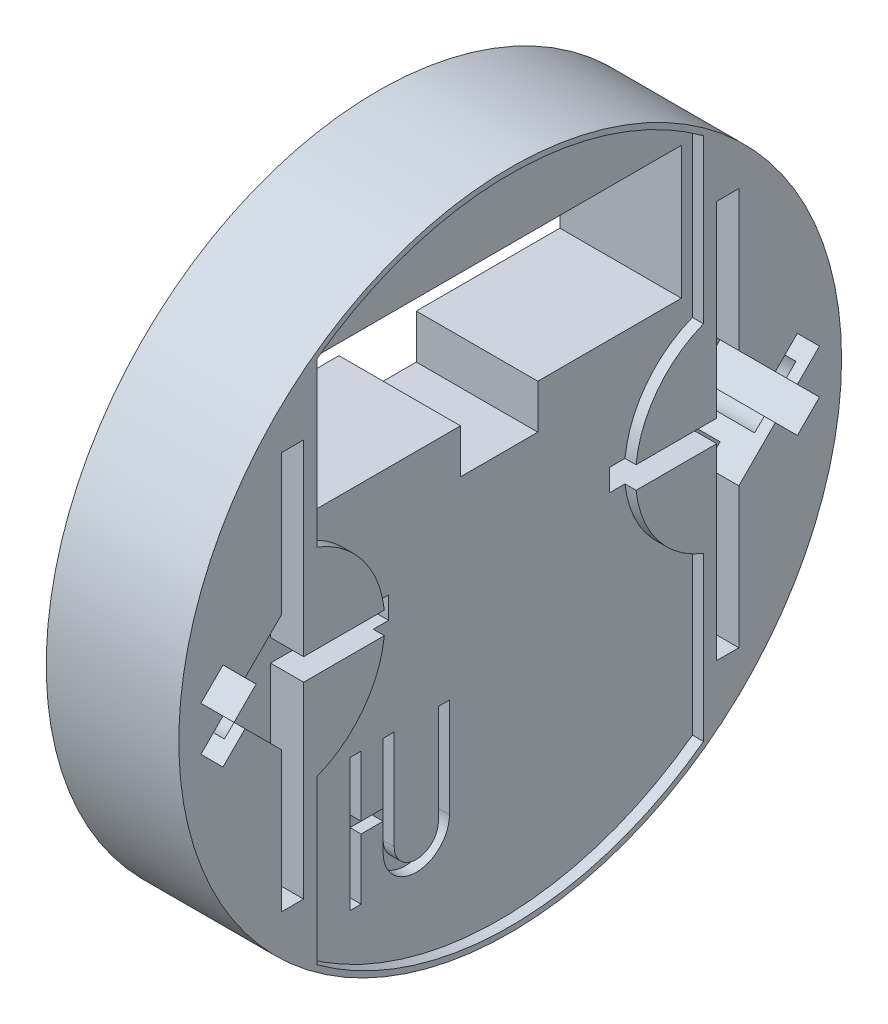
from build123d import *

# Parameters (mm, degrees)
SKETCH1_R           = 15
BOSS_EXTRUDE1_DEPTH = 6
CUT_EXTRUDE1_DEPTH  = 0.5
CUT_EXTRUDE2_DEPTH  = 22.914607001
CUT_EXTRUDE4_DEPTH  = 1.5
CUT_EXTRUDE5_DEPTH  = 22.685248442
CUT_EXTRUDE7_DEPTH  = 0.5
SKETCH7_R           = 1.5
CUT_EXTRUDE6_DEPTH  = 10


with BuildPart() as part:
    # Sketch1 → Boss-Extrude1 (new body)
    with BuildSketch(Plane(origin=(0, 0, 0), x_dir=(0, 0, -1), z_dir=(1, 0, 0))):
        Circle(SKETCH1_R)
    extrude(amount=BOSS_EXTRUDE1_DEPTH)

    # Sketch2 → Cut-Extrude1 (cut)
    with BuildSketch(Plane(origin=(6, 0, 0), x_dir=(0, 0, -1), z_dir=(1, 0, 0))):
        with BuildLine():
            Line((-8.75, 11.874342087), (-8.75, 4.5))
            ThreePointArc((-8.75, 4.5), (-5.671698021, 0), (-8.75, -4.5))
            Line((-8.75, -4.5), (-8.75, -11.874342087))
            ThreePointArc((-8.75, -11.874342087), (0, -14.75), (8.75, -11.874342087))
            Line((8.75, -11.874342087), (8.75, -4.5))
            ThreePointArc((8.75, -4.5), (5.671698021, 0), (8.75, 4.5))
            Line((8.75, 4.5), (8.75, 11.874342087))
            ThreePointArc((8.75, 11.874342087), (0, 14.75), (-8.75, 11.874342087))
        make_face()
    extrude(amount=-CUT_EXTRUDE1_DEPTH, mode=Mode.SUBTRACT)

    # Sketch3 → Cut-Extrude2 (cut, through all)
    with BuildSketch(Plane(origin=(5.5, 0, 0), x_dir=(0, 0, -1), z_dir=(1, 0, 0))):
        Polygon((-8.25, 11.5), (-8.25, 5.5), (-1.75, 5.5), (-1.75, 3.5), (1.75, 3.5), (1.75, 5.5), (8.25, 5.5), (8.25, 11.5), align=None)
    extrude(amount=-CUT_EXTRUDE2_DEPTH, mode=Mode.SUBTRACT)

    # Sketch4 → Cut-Extrude4 (cut)
    with BuildSketch(Plane(origin=(6, 0, 0), x_dir=(0, 0, -1), z_dir=(1, 0, 0))):
        Polygon((-9.35, 9), (-9.35, 0.5), (-5, 0.5), (-5, -0.5), (-9.35, -0.5), (-9.35, -9), (-10.35, -9), (-10.35, -2.65), (-12, -1), (-13, -2), (-14, -1), (-13, 0), (-14, 1), (-13, 2), (-12, 1), (-10.35, 2.65), (-10.35, 9), align=None)
        Polygon((9.35, -0.5), (9.35, -9), (10.35, -9), (10.35, -2.65), (12, -1), (13, -2), (14, -1), (13, 0), (14, 1), (13, 2), (12, 1), (10.35, 2.65), (10.35, 9), (9.35, 9), (9.35, 0.5), (5, 0.5), (5, -0.5), align=None)
    extrude(amount=-CUT_EXTRUDE4_DEPTH, mode=Mode.SUBTRACT)

    # Sketch5 → Cut-Extrude5 (cut, through all)
    with BuildSketch(Plane(origin=(4.5, 0, 0), x_dir=(0, 0, -1), z_dir=(1, 0, 0))):
        Polygon((-12, -1), (-13, -2), (-14, -1), (-13, 0), (-14, 1), (-13, 2), (-12, 1), (-11, 2), (-10, 1), (-11, 0), (-10, -1), (-11, -2), align=None)
        Polygon((12, -1), (11, -2), (10, -1), (11, 0), (10, 1), (11, 2), (12, 1), (13, 2), (14, 1), (13, 0), (14, -1), (13, -2), align=None)
    extrude(amount=-CUT_EXTRUDE5_DEPTH, mode=Mode.SUBTRACT)

    # Sketch6 → Cut-Extrude7 (cut)
    with BuildSketch(Plane(origin=(5.5, 0, 0), x_dir=(0, 0, -1), z_dir=(1, 0, 0))):
        with BuildLine():
            Line((-6.75, -5), (-6.75, -11))
            Line((-6.75, -11), (-6.25, -11))
            Line((-6.25, -11), (-6.25, -8.25))
            Line((-6.25, -8.25), (-5.25, -8.25))
            Line((-5.25, -8.25), (-5.25, -9.5))
            ThreePointArc((-5.25, -9.5), (-3.75, -11), (-2.25, -9.5))
            Line((-2.25, -9.5), (-2.25, -5))
            Line((-2.25, -5), (-2.75, -5))
            Line((-2.75, -5), (-2.75, -9.5))
            ThreePointArc((-2.75, -9.5), (-3.75, -10.5), (-4.75, -9.5))
            Line((-4.75, -9.5), (-4.75, -5))
            Line((-4.75, -5), (-5.25, -5))
            Line((-5.25, -5), (-5.25, -7.75))
            Line((-5.25, -7.75), (-6.25, -7.75))
            Line((-6.25, -7.75), (-6.25, -5))
            Line((-6.25, -5), (-6.75, -5))
        make_face()
    extrude(amount=-CUT_EXTRUDE7_DEPTH, mode=Mode.SUBTRACT)

    # Sketch7 → Cut-Extrude6 (cut)
    with BuildSketch(Plane(origin=(5.5, 0, 0), x_dir=(0, 0, -1), z_dir=(1, 0, 0))):
        with Locations((-12, 0)):
            Circle(SKETCH7_R)
        with Locations((12, 0)):
            Circle(SKETCH7_R)
    extrude(amount=-CUT_EXTRUDE6_DEPTH, mode=Mode.SUBTRACT)


solid = part.part
